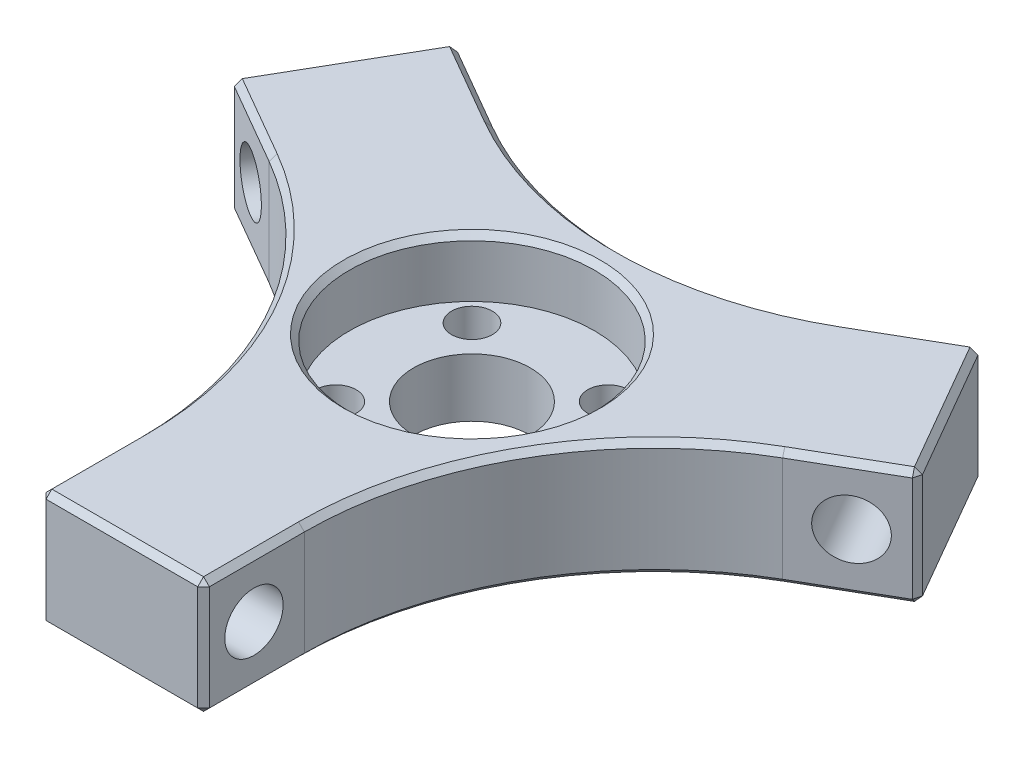
from build123d import *

# Parameters (mm, degrees)
BOSS_EXTRUDE1_DEPTH       = 10
SKETCH8_R                 = 5
CUT_EXTRUDE1_DEPTH        = 44.233266529
FILLET1_R                 = 30
M6X1_0_TAPPED_HOLE1_D     = 5
M6X1_0_TAPPED_HOLE2_D     = 5
M6X1_0_TAPPED_HOLE3_D     = 5
M3_CLEARANCE_HOLE2_D      = 3.5
M3_CLEARANCE_HOLE2_DEPTH  = 12.1
M3_CLEARANCE_HOLE2_TIP    = 1.051506083
F_3_0MM_DOWEL_HOLE2_D     = 3
F_3_0MM_DOWEL_HOLE2_DEPTH = 12.1
F_3_0MM_DOWEL_HOLE2_TIP   = 0.901290929
SKETCH29_R                = 10.5
CUT_EXTRUDE2_DEPTH        = 5
CHAMFER2_SIZE             = 0.5


with BuildPart() as part:
    # Sketch2 → Boss-Extrude1 (new body)
    with BuildSketch(Plane(origin=(0, 0, 0), x_dir=(1, 0, 0), z_dir=(0, 1, 0))):
        Polygon((-22.480762114, 21.062177826), (-29.480762114, 8.937822174), (-7, -4.041451884), (-7, -30), (7, -30), (7, -4.041451884), (29.480762114, 8.937822174), (22.480762114, 21.062177826), (0, 8.082903769), align=None)
    extrude(amount=BOSS_EXTRUDE1_DEPTH)

    # Sketch8 → Cut-Extrude1 (cut, through all)
    with BuildSketch(Plane(origin=(0, 10, 0), x_dir=(1, 0, 0), z_dir=(0, 1, 0))):
        with Locations(Location((0, 0, 0), (0, 0, 270))):
            Circle(SKETCH8_R)
    extrude(amount=-CUT_EXTRUDE1_DEPTH, mode=Mode.SUBTRACT)

    # Fillet1
    fillet1_edges = [part.edges().sort_by_distance(p)[0] for p in [
        (-7, 5, 4.041451884),
        (0, 5, -8.082903769),
        (7, 5, 4.041451884),
    ]]
    fillet(fillet1_edges, radius=FILLET1_R)

    # M6x1.0 Tapped Hole1 (through all)
    with Locations(Plane(origin=(-3.5, 0, -6.062177826), x_dir=(-0.8660254037844384, 0, 0.5000000000000007), z_dir=(-0.5000000000000007, 0, -0.8660254037844384))):
        with Locations((-25.68097998, 5)):
            Hole(M6X1_0_TAPPED_HOLE1_D / 2)

    # M6x1.0 Tapped Hole2 (through all)
    with Locations(Plane(origin=(3.5, 0, -6.062177826), x_dir=(-0.8660254037844383, 0, -0.5000000000000009), z_dir=(0.5000000000000008, 0, -0.8660254037844382))):
        with Locations((25.68097998, 5)):
            Hole(M6X1_0_TAPPED_HOLE2_D / 2)

    # M6x1.0 Tapped Hole3 (through all)
    with Locations(Plane(origin=(7, 0, 0), x_dir=(0, 0, -1), z_dir=(1, 0, 0))):
        with Locations((-25.68097998, 5)):
            Hole(M6X1_0_TAPPED_HOLE3_D / 2)

    # M3 Clearance Hole2
    with Locations(Plane(origin=(0, 10, 0), x_dir=(1, 0, 0), z_dir=(0, 1, 0))):
        with Locations((5.833630945, 5.833630945), (5.833630945, -5.833630945), (-5.833630945, -5.833630945), (-5.833630945, 5.833630945), (0, 0)):
            Hole(M3_CLEARANCE_HOLE2_D / 2, depth=M3_CLEARANCE_HOLE2_DEPTH)
            with Locations((0, 0, -(M3_CLEARANCE_HOLE2_DEPTH + M3_CLEARANCE_HOLE2_TIP / 2))):  # 118° drill point
                Cone(0, M3_CLEARANCE_HOLE2_D / 2, M3_CLEARANCE_HOLE2_TIP, mode=Mode.SUBTRACT)

    # Ø3.0mm Dowel Hole2
    with Locations(Plane(origin=(0, 10, 0), x_dir=(1, 0, 0), z_dir=(0, 1, 0))):
        with Locations((0, -8.25)):
            Hole(F_3_0MM_DOWEL_HOLE2_D / 2, depth=F_3_0MM_DOWEL_HOLE2_DEPTH)
            with Locations((0, 0, -(F_3_0MM_DOWEL_HOLE2_DEPTH + F_3_0MM_DOWEL_HOLE2_TIP / 2))):  # 118° drill point
                Cone(0, F_3_0MM_DOWEL_HOLE2_D / 2, F_3_0MM_DOWEL_HOLE2_TIP, mode=Mode.SUBTRACT)

    # Sketch29 → Cut-Extrude2 (cut)
    with BuildSketch(Plane(origin=(0, 10, 0), x_dir=(1, 0, 0), z_dir=(0, 1, 0))):
        with Locations(Location((0, 0, 0), (0, 0, 270))):
            Circle(SKETCH29_R)
    extrude(amount=-CUT_EXTRUDE2_DEPTH, mode=Mode.SUBTRACT)

    # Chamfer2
    chamfer2_edges = [part.edges().sort_by_distance(p)[0] for p in [
        (7, 10, 25.68097998),
        (25.980762114, 0, -15),
        (7, 0, 25.68097998),
        (0, 10, -10.5),
        (0, 0, 30),
        (-29.480762114, 5, -8.937822174),
        (-22.480762114, 5, -21.062177826),
        (22.480762114, 5, -21.062177826),
        (29.480762114, 5, -8.937822174),
        (7, 5, 30),
        (-7, 5, 30),
        (25.980762114, 10, -15),
        (18.740381057, 10, -18.902667816),
        (-25.980762114, 10, -15),
        (-25.740381057, 10, -6.778312164),
        (25.740381057, 0, -6.778312164),
        (25.740381057, 10, -6.778312164),
        (-7, 0, 25.68097998),
        (-7, 10, 25.68097998),
        (-18.740381057, 0, -18.902667816),
        (-18.740381057, 10, -18.902667816),
        (11.019237886, 0, 6.36195996),
        (11.019237886, 10, 6.36195996),
        (-11.019237886, 0, 6.36195996),
        (-11.019237886, 10, 6.36195996),
        (0, 0, -12.72391992),
        (0, 10, -12.72391992),
        (0, 10, 30),
        (-25.740381057, 0, -6.778312164),
        (-25.980762114, 0, -15),
        (18.740381057, 0, -18.902667816),
    ]]
    chamfer(chamfer2_edges, length=CHAMFER2_SIZE)


solid = part.part
